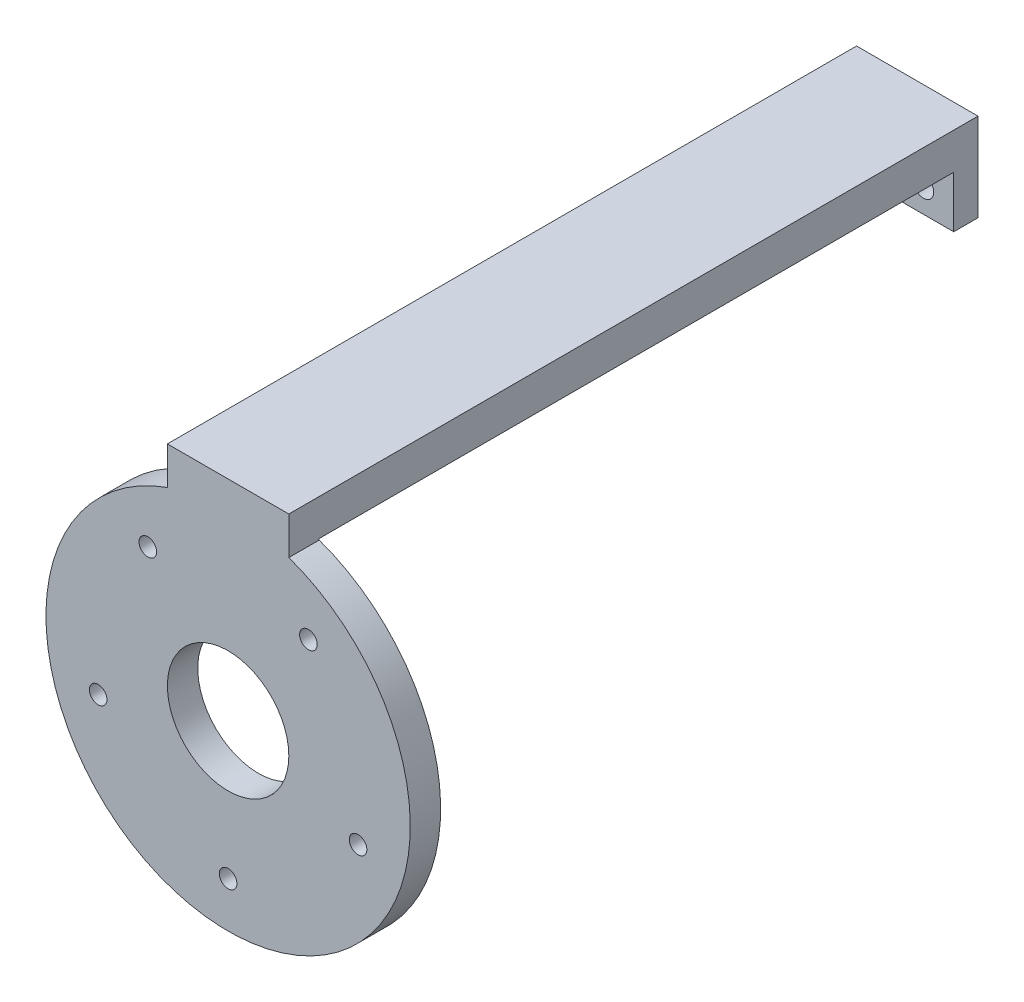
from build123d import *

# Parameters (mm, degrees)
SKETCH1_R           = 30
SKETCH1_R_2         = 10
SKETCH1_R_3         = 1.45
BOSS_EXTRUDE1_DEPTH = 5
SKETCH2_W           = 20
SKETCH2_H           = 14.5
BOSS_EXTRUDE2_DEPTH = 5
SKETCH3_W           = 20
SKETCH3_H           = 113.5
BOSS_EXTRUDE3_DEPTH = 6
SKETCH4_W           = 20
SKETCH4_H           = 14.5
SKETCH4_R           = 1.7
BOSS_EXTRUDE4_DEPTH = 4


with BuildPart() as part:
    # Sketch1 → Boss-Extrude1 (new body)
    with BuildSketch(Plane.XY.offset(384.5)):
        with Locations((300, 300)):
            Circle(SKETCH1_R)
        with Locations((300, 300)):
            Circle(SKETCH1_R_2, mode=Mode.SUBTRACT)
        with Locations((286.774831823, 318.202882373)):
            Circle(SKETCH1_R_3, mode=Mode.SUBTRACT)
        with Locations((278.601228383, 293.047117627)):
            Circle(SKETCH1_R_3, mode=Mode.SUBTRACT)
        with Locations((300, 277.5)):
            Circle(SKETCH1_R_3, mode=Mode.SUBTRACT)
        with Locations((321.398771617, 293.047117627)):
            Circle(SKETCH1_R_3, mode=Mode.SUBTRACT)
        with Locations((313.225168177, 318.202882373)):
            Circle(SKETCH1_R_3, mode=Mode.SUBTRACT)
    extrude(amount=BOSS_EXTRUDE1_DEPTH)

    # Sketch2 → Boss-Extrude2 (add)
    with BuildSketch(Plane.XY.offset(384.5)):
        with Locations((300, 327.25)):
            Rectangle(SKETCH2_W, SKETCH2_H)
    extrude(amount=BOSS_EXTRUDE2_DEPTH)

    # Sketch3 → Boss-Extrude3 (add)
    with BuildSketch(Plane(origin=(0, 328.5, 0), x_dir=(1, 0, 0), z_dir=(0, 1, 0))):
        with Locations((300, -332.75)):
            Rectangle(SKETCH3_W, SKETCH3_H)
    extrude(amount=BOSS_EXTRUDE3_DEPTH)

    # Sketch4 → Boss-Extrude4 (add)
    with BuildSketch(Plane.XY.offset(276)):
        with Locations((300, 327.25)):
            Rectangle(SKETCH4_W, SKETCH4_H)
        with Locations((295, 324)):
            Circle(SKETCH4_R, mode=Mode.SUBTRACT)
        with Locations((305, 324)):
            Circle(SKETCH4_R, mode=Mode.SUBTRACT)
    extrude(amount=BOSS_EXTRUDE4_DEPTH)


solid = part.part
